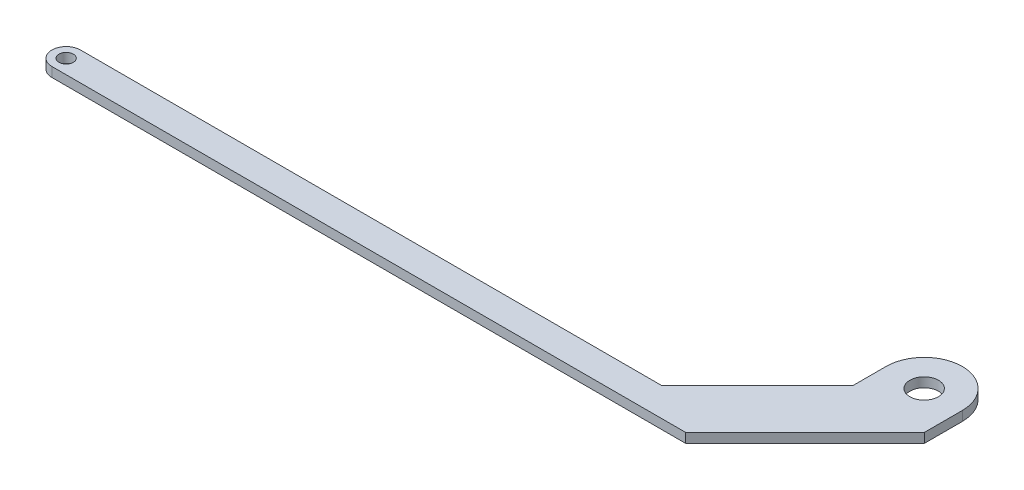
from build123d import *

# Parameters (mm, degrees)
SKETCH1_R           = 1.5
SKETCH1_R_2         = 0.75
BOSS_EXTRUDE1_DEPTH = 1


with BuildPart() as part:
    # Sketch1 → Boss-Extrude1 (new body)
    with BuildSketch(Plane(origin=(0, 0, 0), x_dir=(1, 0, 0), z_dir=(0, 1, 0))):
        with BuildLine():
            Line((-4, 0), (-4, -3.5))
            Line((-4, -3.5), (-14, -13.5))
            Line((-14, -13.5), (-75, -13.5))
            ThreePointArc((-75, -13.5), (-76.5, -15), (-75, -16.5))
            Line((-75, -16.5), (-8.514718626, -16.5))
            Line((-8.514718626, -16.5), (4, -3.985281374))
            Line((4, -3.985281374), (4, 0))
            ThreePointArc((4, 0), (0, 4), (-4, 0))
        make_face()
        with Locations(Location((0, 0, 0), (0, 0, 270))):
            Circle(SKETCH1_R, mode=Mode.SUBTRACT)
        with Locations(Location((-75, -15, 0), (0, 0, 270))):
            Circle(SKETCH1_R_2, mode=Mode.SUBTRACT)
    extrude(amount=BOSS_EXTRUDE1_DEPTH)


solid = part.part
